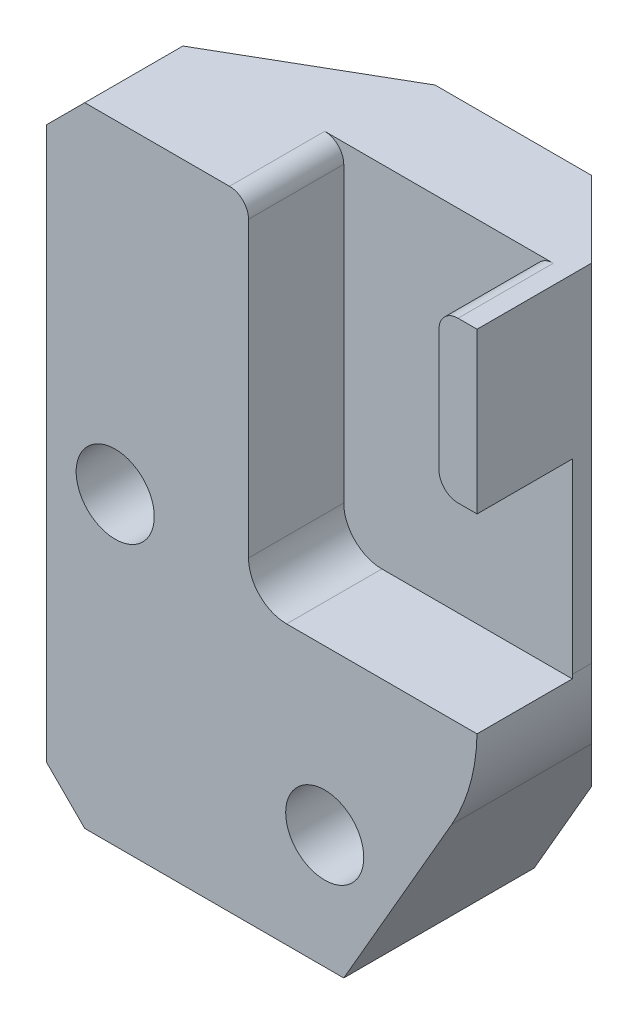
from build123d import *

# Parameters (mm, degrees)
SKETCH_1_W              = 5
SKETCH_1_H              = 20
EXTRUDE_1_DEPTH         = 5
SKETCH1_W               = 5
SKETCH1_H               = 20
EXTRUDE1_DEPTH          = 6.8
M2_5_TAPPED_HOLE1_D     = 2.05
M2_5_TAPPED_HOLE1_DEPTH = 6.35
M2_5_TAPPED_HOLE1_TIP   = 0.615882135
EXTRUDE2_DEPTH          = 2.5
SKETCH3_W               = 11.8
SKETCH3_H               = 3.5
EXTRUDE3_DEPTH          = 5
SKETCH4_W               = 5
SKETCH4_H               = 5
EXTRUDE4_DEPTH          = 2.5
CHAMFER4_SIZE           = 2
SKETCH8_W               = 2
SKETCH8_H               = 5
EXTRUDE6_DEPTH          = 2.5
FILLET1_R               = 0.5
FILLET2_R               = 0.5
CHAMFER6_SIZE           = 3.5
CHAMFER6_SIZE2          = 6.062177826
SKETCH12_W              = 5
SKETCH12_H              = 16.5
EXTRUDE11_DEPTH         = 0.5
EXTRUDE10_REACH         = 21.357
CHAMFER9_SIZE           = 1
FILLET3_R               = 5


with BuildPart() as part:
    # 草图1 → 拉伸1 (new body)
    with BuildSketch(Plane.XY):
        Rectangle(SKETCH_1_W, SKETCH_1_H)
    extrude(amount=EXTRUDE_1_DEPTH)

    # Sketch1 → Extrude1 (add)
    with BuildSketch(Plane.ZY.offset(2.5)):
        with Locations((2.5, 0)):
            Rectangle(SKETCH1_W, SKETCH1_H)
    extrude(amount=EXTRUDE1_DEPTH)

    # M2.5 Tapped Hole1
    with Locations(Plane(origin=(-1.5, -7, 0), x_dir=(-1, 0, 0), z_dir=(0, 0, -1))):
        with Locations((0, 0), (5.5, 5)):
            Hole(M2_5_TAPPED_HOLE1_D / 2, depth=M2_5_TAPPED_HOLE1_DEPTH)
            with Locations((0, 0, -(M2_5_TAPPED_HOLE1_DEPTH + M2_5_TAPPED_HOLE1_TIP / 2))):  # 118° drill point
                Cone(0, M2_5_TAPPED_HOLE1_D / 2, M2_5_TAPPED_HOLE1_TIP, mode=Mode.SUBTRACT)

    # Sketch2 → Extrude2 (cut)
    with BuildSketch(Plane(origin=(0, 0, 5), x_dir=(-1, 0, 0), z_dir=(0, 0, -1))):
        with BuildLine():
            Line((-1.5, -1.7), (-1.5, 5.5))
            ThreePointArc((-1.5, 5.5), (-1.207106781, 6.207106781), (-0.5, 6.5))
            Line((-0.5, 6.5), (2.5, 6.5))
            ThreePointArc((2.5, 6.5), (3.207106781, 6.207106781), (3.5, 5.5))
            Line((3.5, 5.5), (3.5, -1.7))
            ThreePointArc((3.5, -1.7), (3.207106781, -2.407106781), (2.5, -2.7))
            Line((2.5, -2.7), (-0.5, -2.7))
            ThreePointArc((-0.5, -2.7), (-1.207106781, -2.407106781), (-1.5, -1.7))
        make_face()
    extrude(amount=EXTRUDE2_DEPTH, mode=Mode.SUBTRACT)

    # Sketch3 → Extrude3 (cut)
    with BuildSketch(Plane.XY.offset(5)):
        with Locations((-3.4, 8.25)):
            Rectangle(SKETCH3_W, SKETCH3_H)
    extrude(amount=-EXTRUDE3_DEPTH, mode=Mode.SUBTRACT)

    # Sketch4 → Extrude4 (cut)
    with BuildSketch(Plane(origin=(0, 0, 5), x_dir=(-1, 0, 0), z_dir=(0, 0, -1))):
        with Locations((1, 5.5)):
            Rectangle(SKETCH4_W, SKETCH4_H)
    extrude(amount=EXTRUDE4_DEPTH, mode=Mode.SUBTRACT)

    # Chamfer4
    chamfer4_edges = [part.edges().sort_by_distance(p)[0] for p in [
        (2.5, -1.75, 0),
    ]]
    chamfer(chamfer4_edges, length=CHAMFER4_SIZE)

    # Sketch8 → Extrude6 (cut)
    with BuildSketch(Plane.XY.offset(5)):
        with Locations((1.5, -0.2)):
            Rectangle(SKETCH8_W, SKETCH8_H)
    extrude(amount=-EXTRUDE6_DEPTH, mode=Mode.SUBTRACT)

    # Fillet1
    fillet1_edges = [part.edges().sort_by_distance(p)[0] for p in [
        (1.5, 2.3, 3.75),
    ]]
    fillet(fillet1_edges, radius=FILLET1_R)

    # Fillet2
    fillet2_edges = [part.edges().sort_by_distance(p)[0] for p in [
        (-3.5, 6.5, 3.75),
        (1.5, 6.5, 3.75),
    ]]
    fillet(fillet2_edges, radius=FILLET2_R)

    # Chamfer6
    chamfer6_edges = [part.edges().sort_by_distance(p)[0] for p in [
        (2.5, -10, 3.5),
    ]]
    chamfer6_side = [part.faces().sort_by_distance(p)[0] for p in [
        (-3.583625731, -10, 2.564327485),
    ]]
    chamfer(chamfer6_edges, length=CHAMFER6_SIZE, length2=CHAMFER6_SIZE2, reference=chamfer6_side[0])

    # Sketch12 → Extrude11 (cut)
    with BuildSketch(Plane.ZY.offset(9.3)):
        with Locations((2.5, -1.75)):
            Rectangle(SKETCH12_W, SKETCH12_H)
    extrude(amount=-EXTRUDE11_DEPTH, mode=Mode.SUBTRACT)

    # Extrude10: up to this face of the body (flat: up to its plane)
    extrude10_end = Plane(part.part.faces().sort_by_distance((-4.9, -10, 2.5))[0])
    # Sketch13 → Extrude10 (cut, up to the picked face)
    with BuildSketch(Plane(origin=(0, 6.5, 0), x_dir=(1, 0, 0), z_dir=(0, 1, 0)), mode=Mode.PRIVATE) as extrude10_sk1:
        Polygon((-8.8, -3), (-8.8, 0), (-3.603847577, 0), align=None)
    extrude10_tool1 = split(extrude(extrude10_sk1.sketch, amount=-EXTRUDE10_REACH, mode=Mode.PRIVATE), bisect_by=extrude10_end, keep=Keep.BOTH, mode=Mode.PRIVATE)
    add(extrude10_tool1.solids().sort_by(Axis((-7.067949, 6.5, 1), (0, -1, 0)))[0], mode=Mode.SUBTRACT)

    # Chamfer9
    chamfer9_edges = [part.edges().sort_by_distance(p)[0] for p in [
        (-8.8, 6.5, 4),
        (-8.8, -10, 4),
    ]]
    chamfer(chamfer9_edges, length=CHAMFER9_SIZE)

    # Fillet3
    fillet3_edges = [part.edges().sort_by_distance(p)[0] for p in [
        (2.5, -3.937822174, 3.5),
    ]]
    fillet(fillet3_edges, radius=FILLET3_R)


solid = part.part
